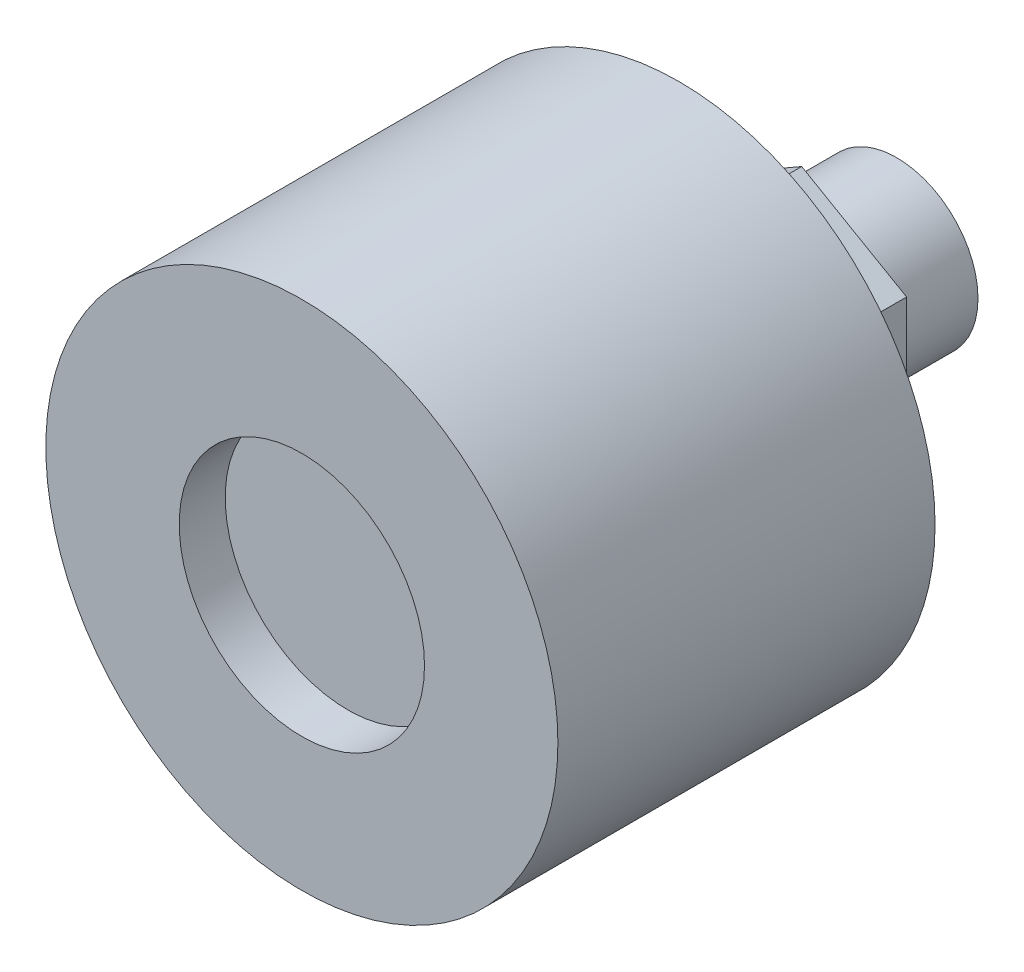
from build123d import *

# Parameters (mm, degrees)
BOSS_EXTRUDE1_DEPTH      = 1
BOSS_EXTRUDE1_DEPTH_BACK = 0.5
SKETCH3_R                = 8.35
SKETCH3_R_2              = 4
SKETCH4_R                = 8.35
BOSS_EXTRUDE2_DEPTH      = 10.8
BOSS_EXTRUDE4_DEPTH      = 4
SKETCH6_R                = 2.65
BOSS_EXTRUDE5_DEPTH      = 3.1
SKETCH7_R                = 0.244312337
CUT_EXTRUDE1_DEPTH       = 2


with BuildPart() as part:
    # Sketch3 → Boss-Extrude1 (new, two sides: drawn at the far end of the back side and taken through both)
    with BuildSketch(Plane.XY.offset(-BOSS_EXTRUDE1_DEPTH_BACK)):
        Circle(SKETCH3_R)
        Circle(SKETCH3_R_2, mode=Mode.SUBTRACT)
    extrude(amount=BOSS_EXTRUDE1_DEPTH + BOSS_EXTRUDE1_DEPTH_BACK)

    # Sketch4 → Boss-Extrude2 (add)
    with BuildSketch(Plane(origin=(0, 0, -0.5), x_dir=(-1, 0, 0), z_dir=(0, 0, -1))):
        with Locations(Location((0, 0, 0), (0, 0, 180))):
            Circle(SKETCH4_R)
    extrude(amount=BOSS_EXTRUDE2_DEPTH)

    # Sketch5 → Boss-Extrude4 (add)
    with BuildSketch(Plane(origin=(0, 0, -11.3), x_dir=(-1, 0, 0), z_dir=(0, 0, -1))):
        Polygon((0, 3.95), (-3.420800345, 1.975), (-3.420800345, -1.975), (0, -3.95), (3.420800345, -1.975), (3.420800345, 1.975), align=None)
    extrude(amount=BOSS_EXTRUDE4_DEPTH)

    # Sketch6 → Boss-Extrude5 (add)
    with BuildSketch(Plane(origin=(0, 0, -15.3), x_dir=(-1, 0, 0), z_dir=(0, 0, -1))):
        with Locations(Location((0, 0, 0), (0, 0, 180))):
            Circle(SKETCH6_R)
    extrude(amount=BOSS_EXTRUDE5_DEPTH)

    # Sketch7 → Cut-Extrude1 (cut)
    with BuildSketch(Plane(origin=(0, 0, -18.4), x_dir=(-1, 0, 0), z_dir=(0, 0, -1))):
        Circle(SKETCH7_R)
    extrude(amount=-CUT_EXTRUDE1_DEPTH, mode=Mode.SUBTRACT)


solid = part.part
